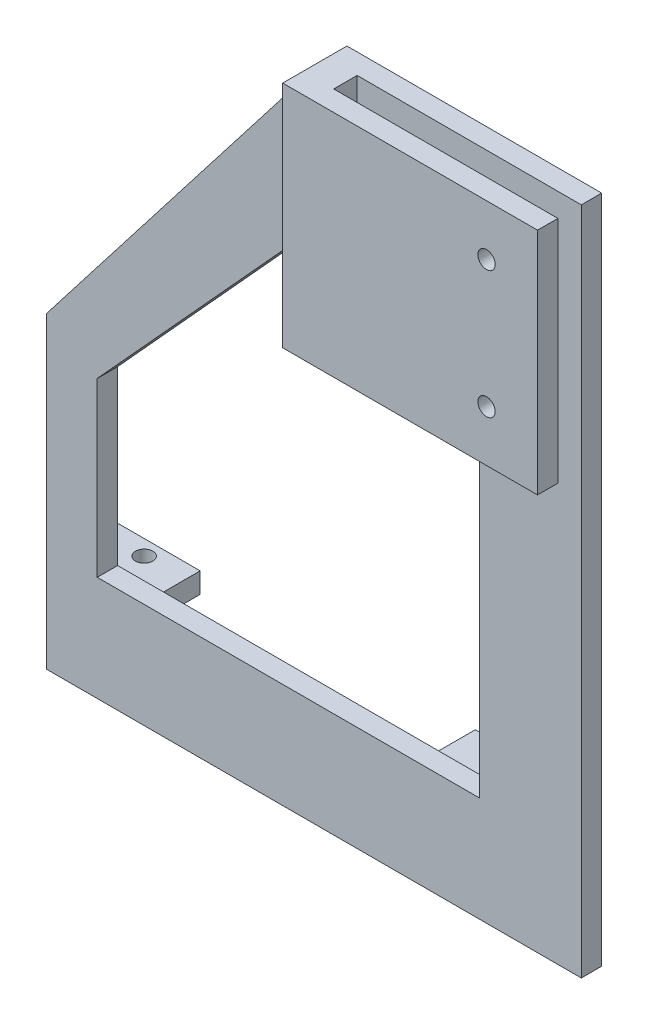
from build123d import *

# Parameters (mm, degrees)
EXTRUDE_START                = 0.2
EXTRUDE_312_DEPTH            = 4
CUT_EXTRUDE_453_DEPTH        = 142.840191765
CUT_EXTRUDE_453_DEPTH_BACK   = 142.840191765
EXTRUDE_START_2              = -8
SKETCH_3_W                   = 16
SKETCH_3_H                   = 4
EXTRUDE_645_DEPTH            = 12.2
EXTRUDE_START_3              = -10
SKETCH_4_W                   = 16
SKETCH_4_H                   = 2.7
EXTRUDE_849_DEPTH            = 14.2
EXTRUDE_START_4              = -2.7
SKETCH_5_W                   = 16
SKETCH_5_H                   = 14.2
SKETCH_5_W_2                 = 6.7
SKETCH_5_H_2                 = 5.8
EXTRUDE_M3_DEPTH             = 2.5
SKETCH_6_W                   = 6
SKETCH_6_H                   = 45
EXTRUDE_1326_DEPTH           = 12.6
EXTRUDE_START_5              = 8.8
SKETCH_7_W                   = 50
SKETCH_7_H                   = 45
EXTRUDE_1474_DEPTH           = 4
CUT_EXTRUDE_3P4_DEPTH        = 143.354627603
CUT_EXTRUDE_3P4_DEPTH_BACK   = 143.354627603
SKETCH_8_R                   = 1.7
CUT_EXTRUDE_3P4_2_DEPTH      = 143.354627603
CUT_EXTRUDE_3P4_2_DEPTH_BACK = 143.354627603
SKETCH_9_R                   = 1.7


with BuildPart() as part:
    # 草图1 → Extrude 312 (new body)
    with BuildSketch(Plane.XY.offset(EXTRUDE_START)):
        Polygon((-65, -5.4), (40, -5.4), (40, 126), (-10, 126), (-65, 55), align=None)
    extrude(amount=EXTRUDE_312_DEPTH)

    # 草图2 → Cut-Extrude 453 (cut, two sides: drawn at the far end of the back side and taken through both)
    with BuildSketch(Plane.XY.offset(-CUT_EXTRUDE_453_DEPTH_BACK)):
        Polygon((-55, 15.2), (20, 15.2), (20, 105), (-4, 105), (-55, 49), align=None)
    extrude(amount=CUT_EXTRUDE_453_DEPTH + CUT_EXTRUDE_453_DEPTH_BACK, mode=Mode.SUBTRACT)

    # 草图3 → Extrude 645 (add)
    with BuildSketch(Plane.XY.offset(EXTRUDE_START_2)):
        with Locations((-55, 12.2)):
            Rectangle(SKETCH_3_W, SKETCH_3_H)
        with Locations((15, 12.2)):
            Rectangle(SKETCH_3_W, SKETCH_3_H)
    extrude(amount=EXTRUDE_645_DEPTH)

    # 草图4 → Extrude 849 (add)
    with BuildSketch(Plane.XY.offset(EXTRUDE_START_3)):
        with Locations((-55, -4.05)):
            Rectangle(SKETCH_4_W, SKETCH_4_H)
        with Locations((15, -4.05)):
            Rectangle(SKETCH_4_W, SKETCH_4_H)
    extrude(amount=EXTRUDE_849_DEPTH)

    # 草图5 → 下卡唇M3螺母防转槽 (add)
    # profile 1 of 2: a face of its own
    with BuildSketch(Plane(origin=(0, 0, 0), x_dir=(1, 0, 0), z_dir=(0, 1, 0)).offset(EXTRUDE_START_4)):
        with Locations((-55, 2.9)):
            Rectangle(SKETCH_5_W, SKETCH_5_H)
        with Locations((-55, 5)):
            Rectangle(SKETCH_5_W_2, SKETCH_5_H_2, mode=Mode.SUBTRACT)
    # profile 2 of 2: a face of its own
    with BuildSketch(Plane(origin=(0, 0, 0), x_dir=(1, 0, 0), z_dir=(0, 1, 0)).offset(EXTRUDE_START_4)):
        with Locations((15, 2.9)):
            Rectangle(SKETCH_5_W, SKETCH_5_H)
        with Locations((15, 5)):
            Rectangle(SKETCH_5_W_2, SKETCH_5_H_2, mode=Mode.SUBTRACT)
    extrude(amount=EXTRUDE_M3_DEPTH)

    # 草图6 → Extrude 1326 (add)
    with BuildSketch(Plane.XY.offset(EXTRUDE_START)):
        with Locations((-7, 103.5)):
            Rectangle(SKETCH_6_W, SKETCH_6_H)
    extrude(amount=EXTRUDE_1326_DEPTH)

    # 草图7 → Extrude 1474 (add)
    with BuildSketch(Plane.XY.offset(EXTRUDE_START_5)):
        with Locations((15, 103.5)):
            Rectangle(SKETCH_7_W, SKETCH_7_H)
    extrude(amount=EXTRUDE_1474_DEPTH)

    # 草图8 → Cut-Extrude 3p4 (cut, two sides: drawn at the far end of the back side and taken through both)
    with BuildSketch(Plane.XY.offset(-CUT_EXTRUDE_3P4_DEPTH_BACK)):
        with Locations((30, 91)):
            Circle(SKETCH_8_R)
        with Locations((30, 116)):
            Circle(SKETCH_8_R)
    extrude(amount=CUT_EXTRUDE_3P4_DEPTH + CUT_EXTRUDE_3P4_DEPTH_BACK, mode=Mode.SUBTRACT)

    # 草图9 → Cut-Extrude 3p4 2 (cut, two sides: drawn at the far end of the back side and taken through both)
    with BuildSketch(Plane(origin=(0, 0, 0), x_dir=(1, 0, 0), z_dir=(0, 1, 0)).offset(-CUT_EXTRUDE_3P4_2_DEPTH_BACK)):
        with Locations(Location((-55, 5, 0), (0, 0, 270))):
            Circle(SKETCH_9_R)
        with Locations(Location((15, 5, 0), (0, 0, 270))):
            Circle(SKETCH_9_R)
    extrude(amount=CUT_EXTRUDE_3P4_2_DEPTH + CUT_EXTRUDE_3P4_2_DEPTH_BACK, mode=Mode.SUBTRACT)


solid = part.part
